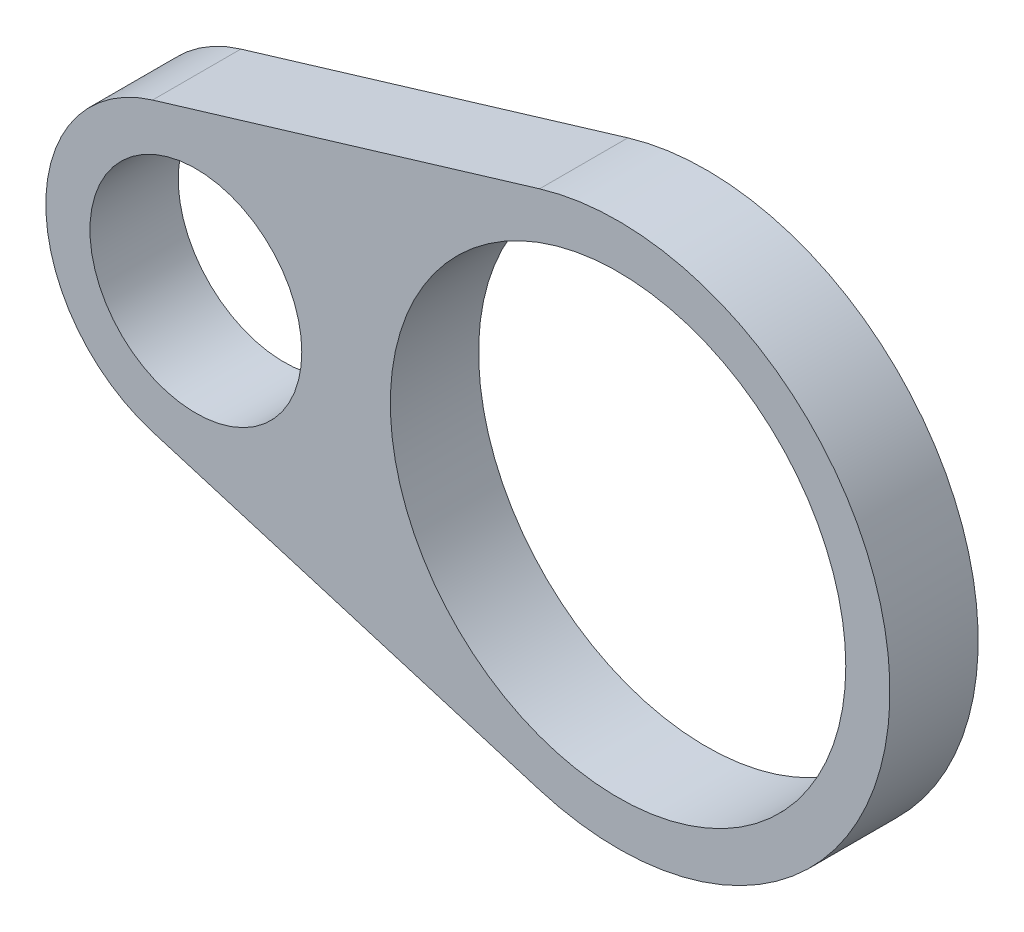
from build123d import *

# Parameters (mm, degrees)
ESBO_O2_R                = 25.8
ESBO_O2_R_2              = 12
RESSALTO_EXTRUS_O1_DEPTH = 10


with BuildPart() as part:
    # Esboço2 → Ressalto-extrusão1 (new body)
    with BuildSketch(Plane.XY):
        with BuildLine():
            Line((-28.81987142, 16.277046303), (15.028527075, 29.490178008))
            ThreePointArc((15.028527075, 29.490178008), (54.715, 0), (15.028527075, -29.490178008))
            Line((15.028527075, -29.490178008), (-28.81987142, -16.277046303))
            ThreePointArc((-28.81987142, -16.277046303), (-40.915, 0), (-28.81987142, 16.277046303))
        make_face()
        with Locations((23.915, 0)):
            Circle(ESBO_O2_R, mode=Mode.SUBTRACT)
        with Locations((-23.915, 0)):
            Circle(ESBO_O2_R_2, mode=Mode.SUBTRACT)
    extrude(amount=RESSALTO_EXTRUS_O1_DEPTH)


solid = part.part
